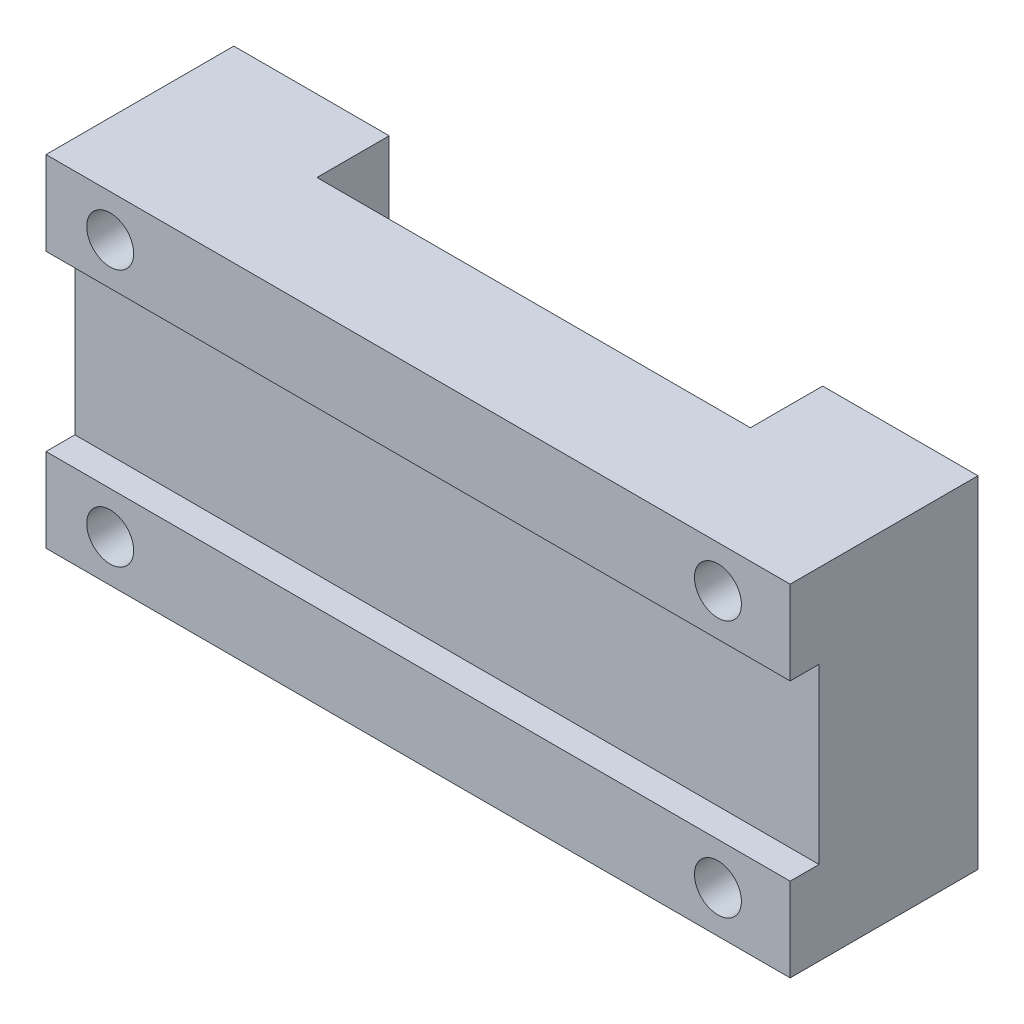
from build123d import *

# Parameters (mm, degrees)
CROQUIS2_W              = 51.502836605
CROQUIS2_H              = 23.6
SALIENTE_EXTRUIR1_DEPTH = 11
CROQUIS4_W              = 2
CROQUIS4_H              = 5.8
SALIENTE_EXTRUIR2_DEPTH = 51.502837
CORTAR_EXTRUIR1_START   = -23.6
CORTAR_EXTRUIR1_DEPTH   = 23.6
CORTAR_EXTRUIR2_START   = -13
CROQUIS6_R              = 1.625
CORTAR_EXTRUIR2_DEPTH   = 13


with BuildPart() as part:
    # Croquis2 → Saliente-Extruir1 (new body)
    with BuildSketch(Plane.XY):
        with Locations((49.751418302, 20)):
            Rectangle(CROQUIS2_W, CROQUIS2_H)
    extrude(amount=SALIENTE_EXTRUIR1_DEPTH)

    # Croquis4 → Saliente-Extruir2 (add)
    with BuildSketch(Plane(origin=(75.502836605, 0, 0), x_dir=(0, 0, -1), z_dir=(1, 0, 0))):
        with Locations((-12, 11.1)):
            Rectangle(CROQUIS4_W, CROQUIS4_H)
        with Locations((-12, 28.9)):
            Rectangle(CROQUIS4_W, CROQUIS4_H)
    extrude(amount=-SALIENTE_EXTRUIR2_DEPTH)

    # Croquis5 → Cortar-Extruir1 (cut)
    with BuildSketch(Plane.XZ.offset(-8.2).offset(CORTAR_EXTRUIR1_START)):
        Polygon((49.751418302, 0), (34.751418302, 0), (34.751418302, 5), (49.751418302, 5), (64.751418302, 5), (64.751418302, 0), align=None)
    extrude(amount=CORTAR_EXTRUIR1_DEPTH, mode=Mode.SUBTRACT)

    # Croquis6 → Cortar-Extruir2 (cut)
    with BuildSketch(Plane.XY.offset(13).offset(CORTAR_EXTRUIR2_START)):
        with Locations((28.442619987, 11.1)):
            Circle(CROQUIS6_R)
        with Locations((28.442619987, 28.9)):
            Circle(CROQUIS6_R)
        with Locations((70.502836605, 11.1)):
            Circle(CROQUIS6_R)
        with Locations((70.502836605, 28.9)):
            Circle(CROQUIS6_R)
    extrude(amount=CORTAR_EXTRUIR2_DEPTH, mode=Mode.SUBTRACT)


solid = part.part
